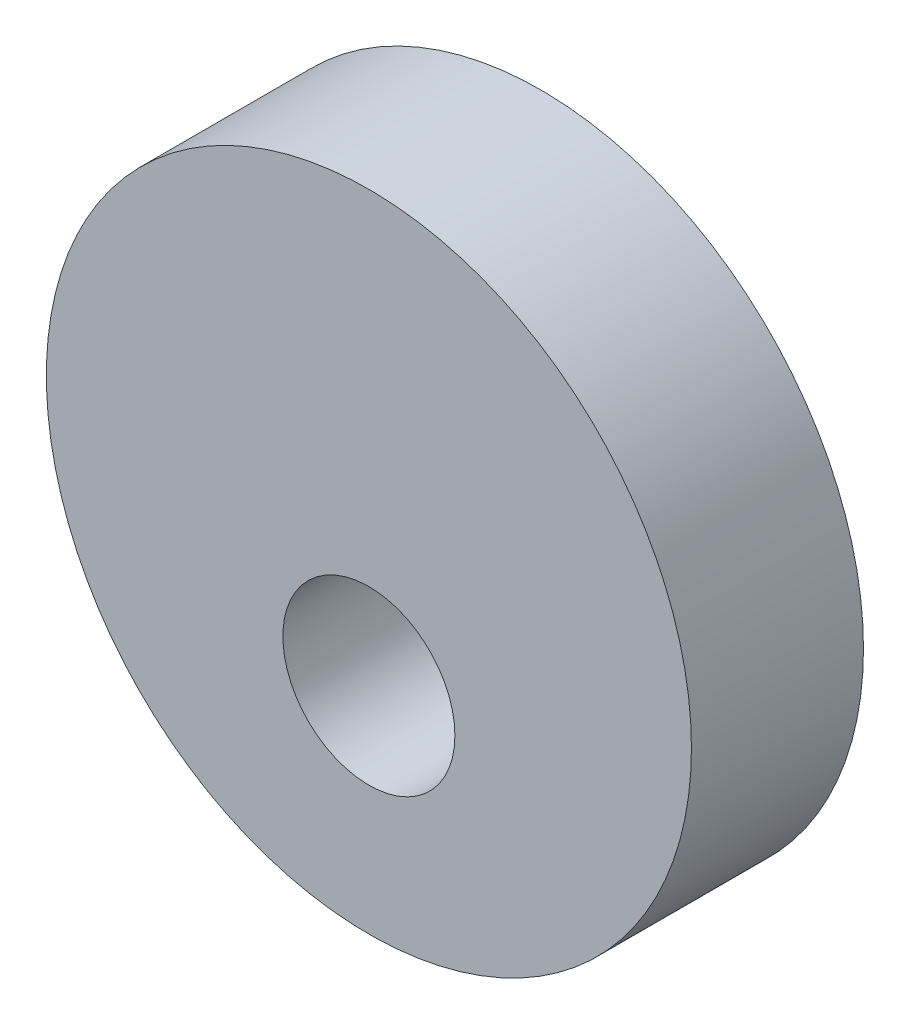
from build123d import *

# Parameters (mm, degrees)
SKETCH1_R           = 15
BOSS_EXTRUDE1_DEPTH = 8
SKETCH2_R           = 4
CUT_EXTRUDE1_DEPTH  = 10


with BuildPart() as part:
    # Sketch1 → Boss-Extrude1 (new body)
    with BuildSketch(Plane.XY):
        Circle(SKETCH1_R)
    extrude(amount=BOSS_EXTRUDE1_DEPTH)

    # Sketch2 → Cut-Extrude1 (cut)
    with BuildSketch(Plane.XY.offset(8)):
        with Locations((0, -5)):
            Circle(SKETCH2_R)
    extrude(amount=-CUT_EXTRUDE1_DEPTH, mode=Mode.SUBTRACT)


solid = part.part
